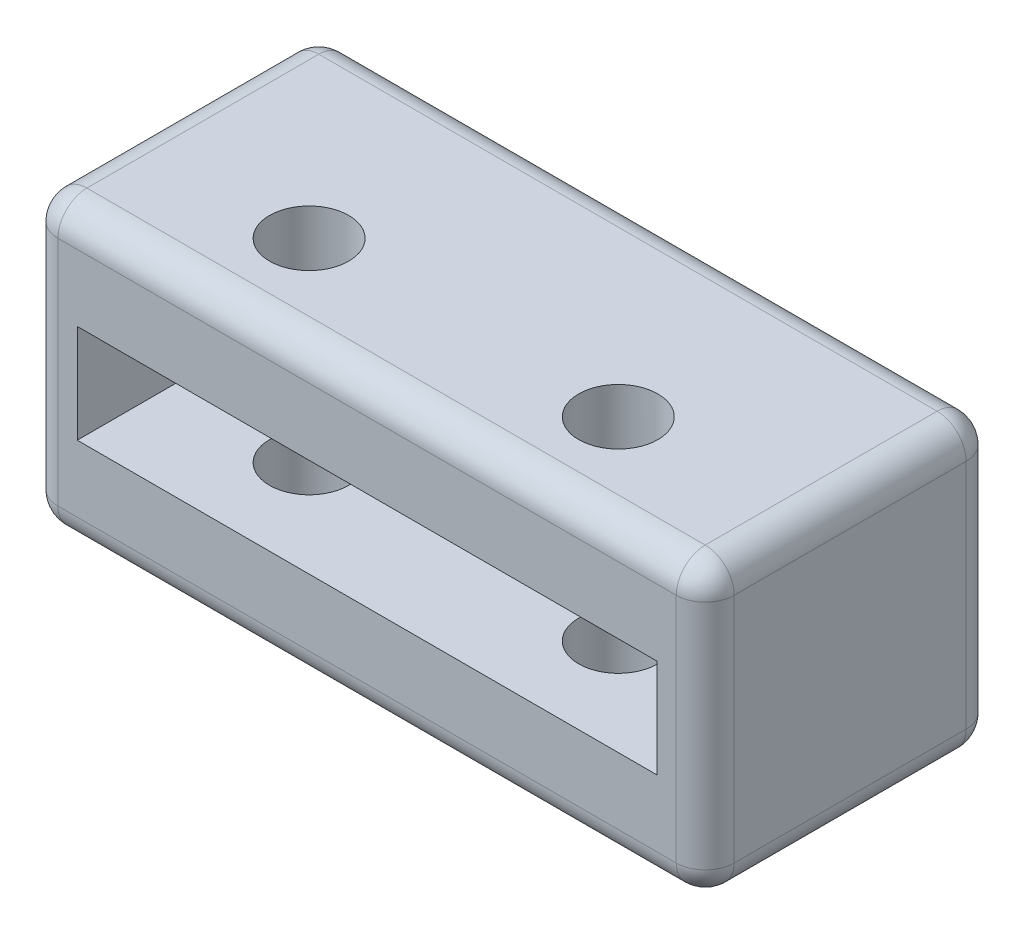
from build123d import *

# Parameters (mm, degrees)
BOSS_EXTRU_1_DEPTH           = 35
ESQUISSE2_W                  = 30
ESQUISSE2_H                  = 5.1
ENL_V_MAT_EXTRU_1_DEPTH      = 10
ENL_V_MAT_EXTRU_2_DEPTH      = 38.178656511
ENL_V_MAT_EXTRU_2_DEPTH_BACK = 38.178656511
ESQUISSE3_R                  = 2.05
CONG_1_R                     = 1.5


with BuildPart() as part:
    # Esquisse1 → Boss.-Extru.1 (new body)
    with BuildSketch(Plane(origin=(0, 0, 0), x_dir=(0, 0, -1), z_dir=(1, 0, 0))):
        with BuildLine():
            Line((6, 7.5), (-6, 7.5))
            ThreePointArc((-6, 7.5), (-7.060660172, 7.060660172), (-7.5, 6))
            Line((-7.5, 6), (-7.5, -6))
            ThreePointArc((-7.5, -6), (-7.060660172, -7.060660172), (-6, -7.5))
            Line((-6, -7.5), (6, -7.5))
            ThreePointArc((6, -7.5), (7.060660172, -7.060660172), (7.5, -6))
            Line((7.5, -6), (7.5, 6))
            ThreePointArc((7.5, 6), (7.060660172, 7.060660172), (6, 7.5))
        make_face()
    extrude(amount=BOSS_EXTRU_1_DEPTH)

    # Esquisse2 → Enlèv. mat.-Extru.1 (cut)
    with BuildSketch(Plane.XY.offset(7.5)):
        with Locations((17.5, 0)):
            Rectangle(ESQUISSE2_W, ESQUISSE2_H)
    extrude(amount=-ENL_V_MAT_EXTRU_1_DEPTH, mode=Mode.SUBTRACT)

    # Esquisse3 → Enlèv. mat.-Extru.2 (cut, two sides: drawn at the far end of the back side and taken through both)
    with BuildSketch(Plane(origin=(0, -2.55, 0), x_dir=(1, 0, 0), z_dir=(0, 1, 0)).offset(-ENL_V_MAT_EXTRU_2_DEPTH_BACK)):
        with Locations(Location((9.5, -2.5, 0), (0, 0, 180))):
            Circle(ESQUISSE3_R)
        with Locations((25.5, -2.5)):
            Circle(ESQUISSE3_R)
    extrude(amount=ENL_V_MAT_EXTRU_2_DEPTH + ENL_V_MAT_EXTRU_2_DEPTH_BACK, mode=Mode.SUBTRACT)

    # Congé1
    cong_1_edges = [part.edges().sort_by_distance(p)[0] for p in [
        (0, 0, 7.5),
        (0, 7.060660172, 7.060660172),
        (0, 7.5, 0),
        (0, 7.060660172, -7.060660172),
        (35, 7.060660172, 7.060660172),
        (35, 0, 7.5),
        (35, -7.060660172, 7.060660172),
        (35, -7.5, 0),
        (35, -7.060660172, -7.060660172),
        (35, 0, -7.5),
        (35, 7.060660172, -7.060660172),
        (0, 0, -7.5),
        (35, 7.5, 0),
        (0, -7.060660172, -7.060660172),
        (0, -7.5, 0),
        (0, -7.060660172, 7.060660172),
    ]]
    fillet(cong_1_edges, radius=CONG_1_R)


solid = part.part
